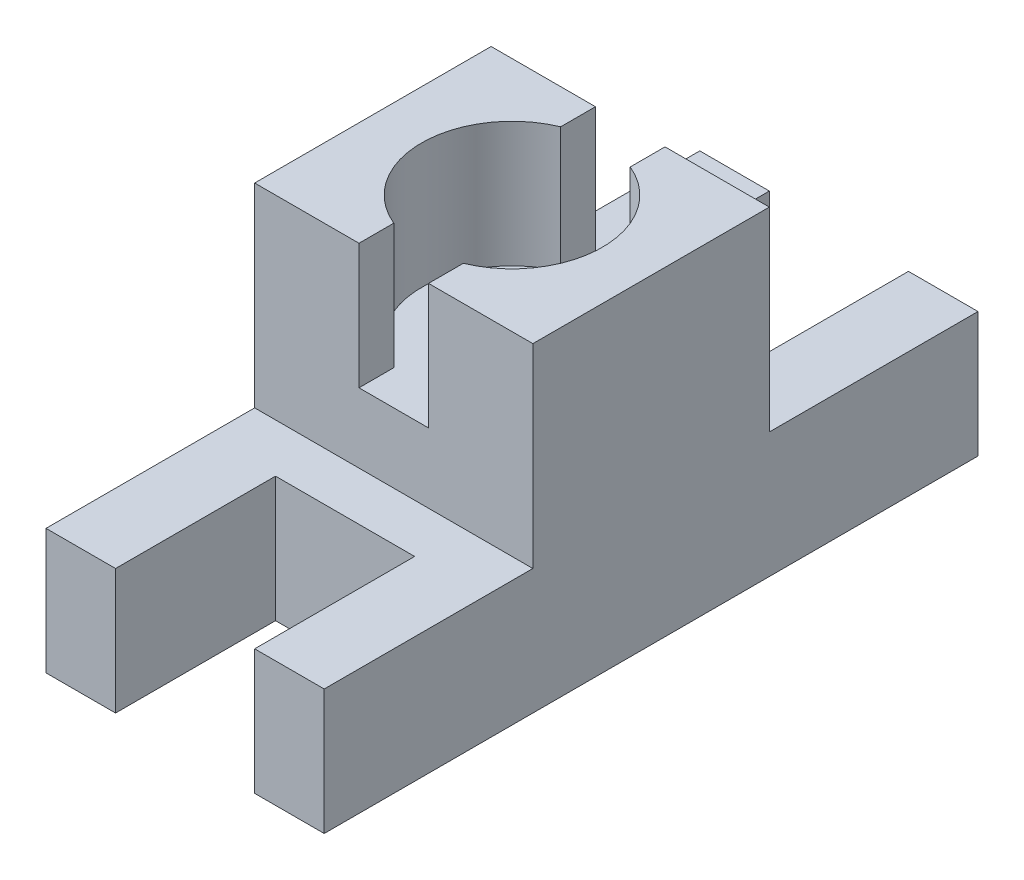
from build123d import *

# Parameters (mm, degrees)
SALIENTE_EXTRUIR1_DEPTH = 20
CROQUIS2_W              = 20
CROQUIS2_H              = 23
CORTAR_EXTRUIR1_DEPTH   = 101.09995005
CORTAR_EXTRUIR3_DEPTH   = 18


with BuildPart() as part:
    # Croquis1 → Saliente-Extruir1 (new, symmetric)
    with BuildSketch(Plane(origin=(0, 0, 0), x_dir=(0, 0, -1), z_dir=(1, 0, 0))):
        Polygon((0, 0), (-94, 0), (-94, 18), (-64, 18), (-64, 46), (-30, 46), (-30, 18), (0, 18), align=None)
    extrude(amount=SALIENTE_EXTRUIR1_DEPTH, both=True)

    # Croquis2 → Cortar-Extruir1 (cut, through all)
    with BuildSketch(Plane(origin=(0, 18, 0), x_dir=(1, 0, 0), z_dir=(0, 1, 0))):
        with Locations((0, -82.5)):
            Rectangle(CROQUIS2_W, CROQUIS2_H)
        with Locations((0, -11.5)):
            Rectangle(CROQUIS2_W, CROQUIS2_H)
    extrude(amount=-CORTAR_EXTRUIR1_DEPTH, mode=Mode.SUBTRACT)

    # Croquis3 → Cortar-Extruir3 (cut)
    with BuildSketch(Plane(origin=(0, 46, 0), x_dir=(1, 0, 0), z_dir=(0, 1, 0))):
        with BuildLine():
            Line((5, -59), (5, -64))
            Line((5, -64), (-5, -64))
            Line((-5, -64), (-5, -59))
            ThreePointArc((-5, -59), (-13, -47), (-5, -35))
            Line((-5, -35), (-5, -30))
            Line((-5, -30), (5, -30))
            Line((5, -30), (5, -35))
            ThreePointArc((5, -35), (13, -47), (5, -59))
        make_face()
    extrude(amount=-CORTAR_EXTRUIR3_DEPTH, mode=Mode.SUBTRACT)


solid = part.part
